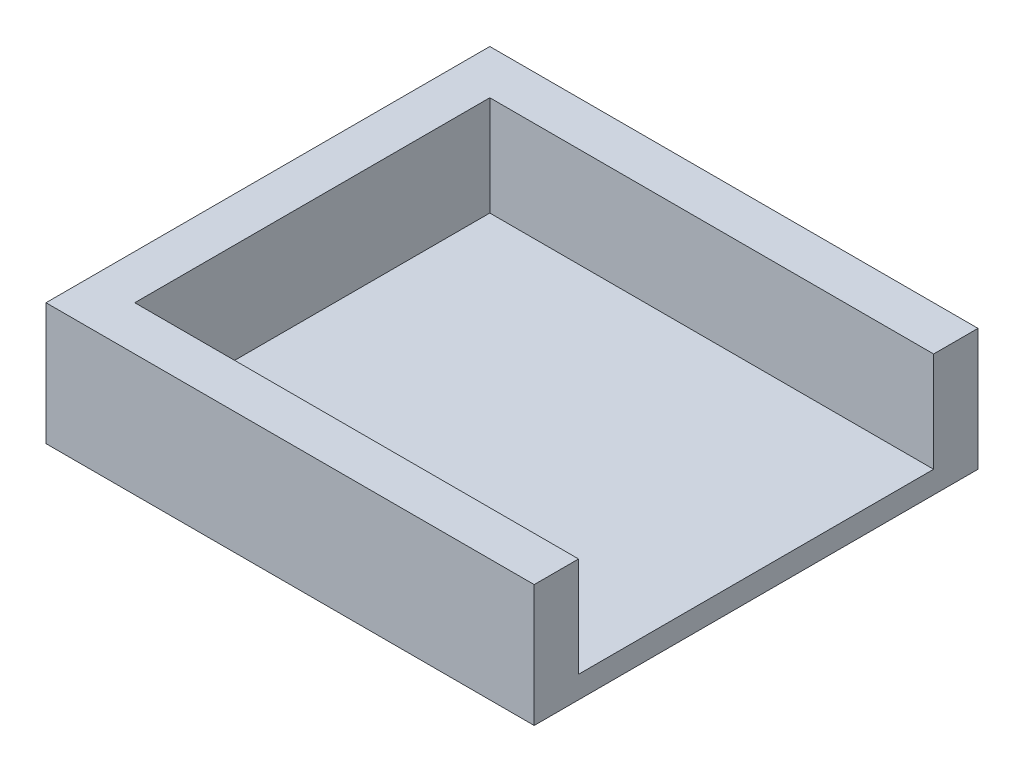
from build123d import *

# Parameters (mm, degrees)
BOSS_EXTRUDE1_DEPTH = 45
SKETCH2_W           = 220
SKETCH2_H           = 200
BOSS_EXTRUDE2_DEPTH = 10


with BuildPart() as part:
    # Sketch1 → Boss-Extrude1 (new body)
    with BuildSketch(Plane(origin=(0, 0, 0), x_dir=(1, 0, 0), z_dir=(0, 1, 0))):
        Polygon((-110, -100), (-110, 100), (110, 100), (110, 80), (-90, 80), (-90, -80), (110, -80), (110, -100), align=None)
    extrude(amount=BOSS_EXTRUDE1_DEPTH)

    # Sketch2 → Boss-Extrude2 (add)
    with BuildSketch(Plane(origin=(0, 0, 0), x_dir=(-1, 0, 0), z_dir=(0, -1, 0))):
        Rectangle(SKETCH2_W, SKETCH2_H)
    extrude(amount=BOSS_EXTRUDE2_DEPTH)


solid = part.part
